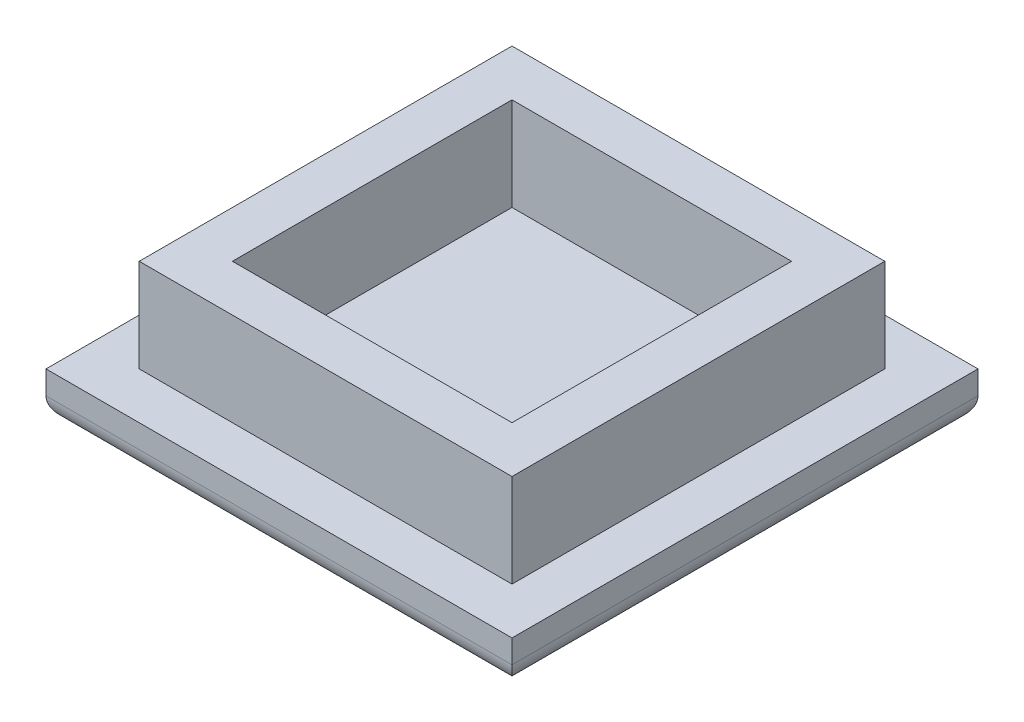
from build123d import *

# Parameters (mm, degrees)
SKETCH1_W           = 20
SKETCH1_H           = 20
BOSS_EXTRUDE1_DEPTH = 2
SKETCH2_W           = 16
SKETCH2_H           = 16
SKETCH2_W_2         = 12
SKETCH2_H_2         = 12
BOSS_EXTRUDE2_DEPTH = 4
FILLET1_R           = 1


with BuildPart() as part:
    # Sketch1 → Boss-Extrude1 (new body)
    with BuildSketch(Plane(origin=(0, 0, 0), x_dir=(1, 0, 0), z_dir=(0, 1, 0))):
        Rectangle(SKETCH1_W, SKETCH1_H)
    extrude(amount=BOSS_EXTRUDE1_DEPTH)

    # Sketch2 → Boss-Extrude2 (add)
    with BuildSketch(Plane(origin=(0, 2, 0), x_dir=(1, 0, 0), z_dir=(0, 1, 0))):
        Rectangle(SKETCH2_W, SKETCH2_H)
        Rectangle(SKETCH2_W_2, SKETCH2_H_2, mode=Mode.SUBTRACT)
    extrude(amount=BOSS_EXTRUDE2_DEPTH)

    # Fillet1
    fillet1_edges = [part.edges().sort_by_distance(p)[0] for p in [
        (0, 0, 10),
        (-10, 0, 0),
        (0, 0, -10),
        (10, 0, 0),
    ]]
    fillet(fillet1_edges, radius=FILLET1_R)


solid = part.part
